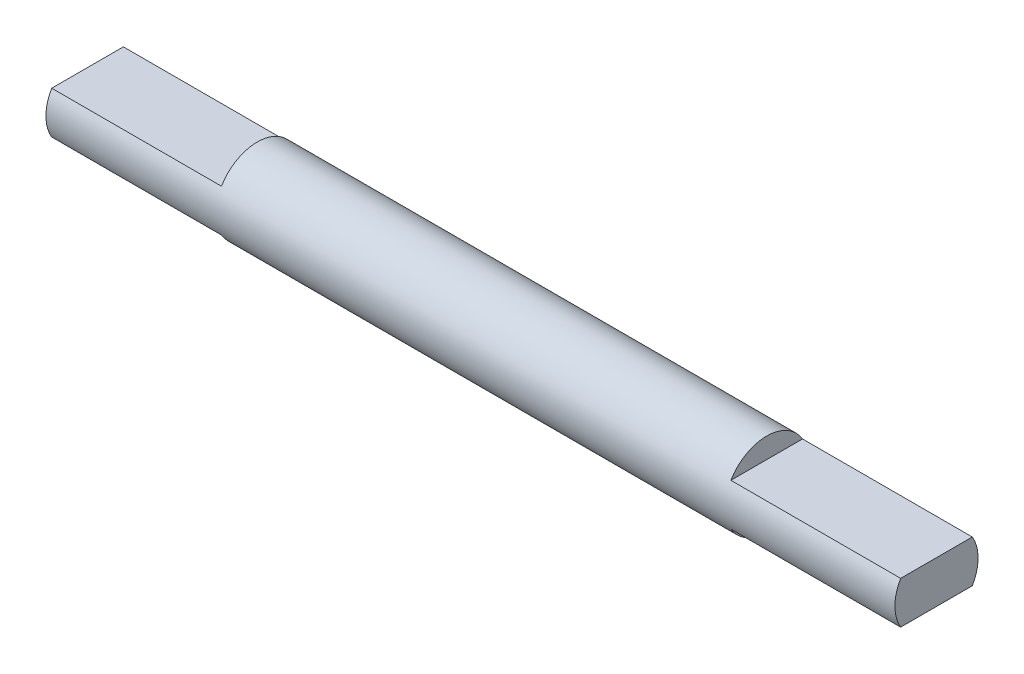
from build123d import *

# Parameters (mm, degrees)
SKETCH1_R           = 2.45
BOSS_EXTRUDE1_DEPTH = 50
CUT_EXTRUDE1_START  = -10
CUT_EXTRUDE1_DEPTH  = 10
CUT_EXTRUDE2_START  = -50
CUT_EXTRUDE2_DEPTH  = 10


with BuildPart() as part:
    # Sketch1 → Boss-Extrude1 (new body)
    with BuildSketch(Plane(origin=(0, 0, 0), x_dir=(0, 0, -1), z_dir=(1, 0, 0))):
        Circle(SKETCH1_R)
    extrude(amount=BOSS_EXTRUDE1_DEPTH)

    # Sketch2 → Cut-Extrude1 (cut)
    with BuildSketch(Plane(origin=(50, 0, 0), x_dir=(0, 0, -1), z_dir=(1, 0, 0)).offset(CUT_EXTRUDE1_START)):
        with BuildLine():
            Line((-2.110088861, 1.245), (2.110088861, 1.245))
            ThreePointArc((2.110088861, 1.245), (0, 2.45), (-2.110088861, 1.245))
        make_face()
        with BuildLine():
            Line((-2.110088861, -1.245), (2.110088861, -1.245))
            ThreePointArc((2.110088861, -1.245), (0, -2.45), (-2.110088861, -1.245))
        make_face()
    extrude(amount=CUT_EXTRUDE1_DEPTH, mode=Mode.SUBTRACT)

    # Sketch2<2> → Cut-Extrude2 (cut)
    with BuildSketch(Plane(origin=(50, 0, 0), x_dir=(0, 0, -1), z_dir=(1, 0, 0)).offset(CUT_EXTRUDE2_START)):
        with BuildLine():
            Line((-2.110088861, 1.245), (2.110088861, 1.245))
            ThreePointArc((2.110088861, 1.245), (0, 2.45), (-2.110088861, 1.245))
        make_face()
        with BuildLine():
            Line((-2.110088861, -1.245), (2.110088861, -1.245))
            ThreePointArc((2.110088861, -1.245), (0, -2.45), (-2.110088861, -1.245))
        make_face()
    extrude(amount=CUT_EXTRUDE2_DEPTH, mode=Mode.SUBTRACT)


solid = part.part
